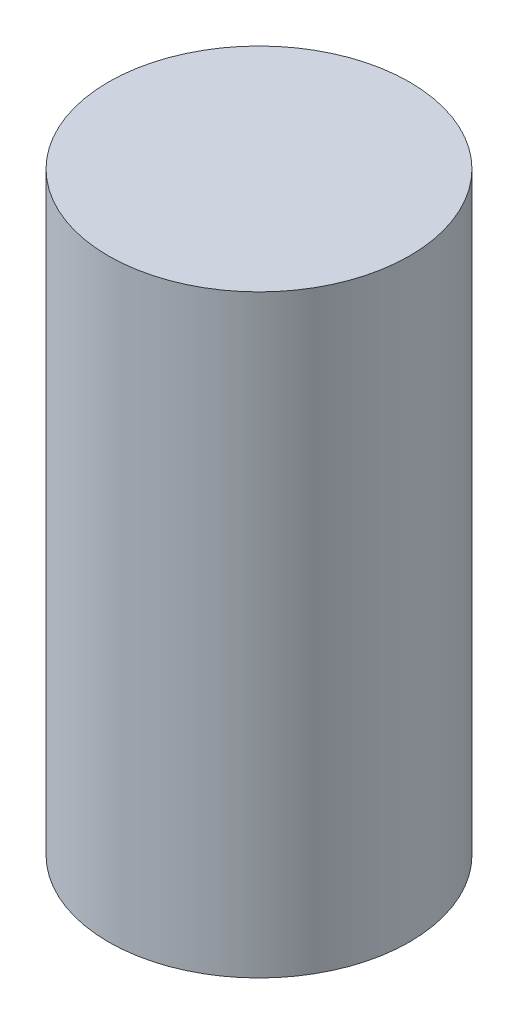
from build123d import *

# Parameters (mm, degrees)
SKETCH1_R           = 5.5
BOSS_EXTRUDE1_DEPTH = 21.7


with BuildPart() as part:
    # Sketch1 → Boss-Extrude1 (new body)
    with BuildSketch(Plane(origin=(0, 0, 0), x_dir=(1, 0, 0), z_dir=(0, 1, 0))):
        with Locations(Location((0, 0, 0), (0, 0, 270))):
            Circle(SKETCH1_R)
    extrude(amount=BOSS_EXTRUDE1_DEPTH)


solid = part.part
